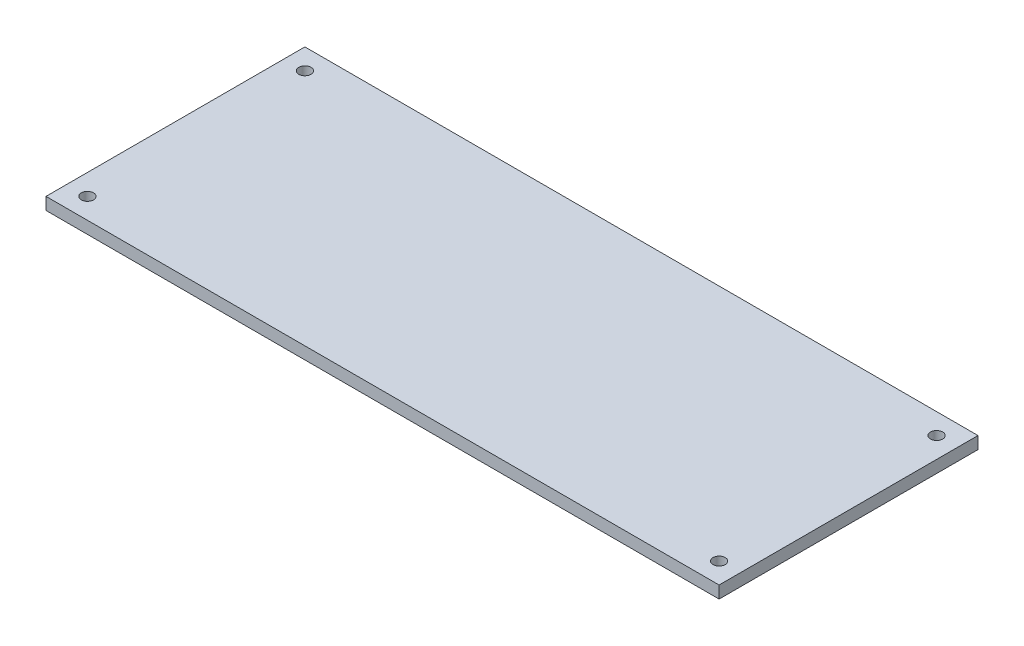
from build123d import *

# Parameters (mm, degrees)
SKETCH1_W           = 165.1
SKETCH1_H           = 63.5
BOSS_EXTRUDE1_DEPTH = 3
CUT_EXTRUDE1_REACH  = 90.496
SKETCH2_R           = 1.5


with BuildPart() as part:
    # Sketch1 → Boss-Extrude1 (new body)
    with BuildSketch(Plane(origin=(0, 0, 0), x_dir=(1, 0, 0), z_dir=(0, 1, 0))):
        Rectangle(SKETCH1_W, SKETCH1_H)
    extrude(amount=BOSS_EXTRUDE1_DEPTH)

    # Sketch2 → Cut-Extrude1 (cut, up to next)
    with BuildSketch(Plane(origin=(0, 3, 0), x_dir=(1, 0, 0), z_dir=(0, 1, 0)), mode=Mode.PRIVATE) as cut_extrude1_sk1:
        with Locations(Location((-77.47, 26.67, 0), (0, 0, 270))):
            Circle(SKETCH2_R)
    cut_extrude1_tool1 = extrude(cut_extrude1_sk1.sketch, amount=-CUT_EXTRUDE1_REACH, mode=Mode.PRIVATE) & part.part
    # Sketch2 → Cut-Extrude1 (cut, up to next)
    with BuildSketch(Plane(origin=(0, 3, 0), x_dir=(1, 0, 0), z_dir=(0, 1, 0)), mode=Mode.PRIVATE) as cut_extrude1_sk2:
        with Locations(Location((-77.47, -26.67, 0), (0, 0, 270))):
            Circle(SKETCH2_R)
    cut_extrude1_tool2 = extrude(cut_extrude1_sk2.sketch, amount=-CUT_EXTRUDE1_REACH, mode=Mode.PRIVATE) & part.part
    # Sketch2 → Cut-Extrude1 (cut, up to next)
    with BuildSketch(Plane(origin=(0, 3, 0), x_dir=(1, 0, 0), z_dir=(0, 1, 0)), mode=Mode.PRIVATE) as cut_extrude1_sk3:
        with Locations(Location((77.47, 26.67, 0), (0, 0, 270))):
            Circle(SKETCH2_R)
    cut_extrude1_tool3 = extrude(cut_extrude1_sk3.sketch, amount=-CUT_EXTRUDE1_REACH, mode=Mode.PRIVATE) & part.part
    # Sketch2 → Cut-Extrude1 (cut, up to next)
    with BuildSketch(Plane(origin=(0, 3, 0), x_dir=(1, 0, 0), z_dir=(0, 1, 0)), mode=Mode.PRIVATE) as cut_extrude1_sk4:
        with Locations(Location((77.47, -26.67, 0), (0, 0, 270))):
            Circle(SKETCH2_R)
    cut_extrude1_tool4 = extrude(cut_extrude1_sk4.sketch, amount=-CUT_EXTRUDE1_REACH, mode=Mode.PRIVATE) & part.part
    add(cut_extrude1_tool1.solids().sort_by_distance((-77.47, 3, -26.67))[0], mode=Mode.SUBTRACT)
    add(cut_extrude1_tool2.solids().sort_by_distance((-77.47, 3, 26.67))[0], mode=Mode.SUBTRACT)
    add(cut_extrude1_tool3.solids().sort_by_distance((77.47, 3, -26.67))[0], mode=Mode.SUBTRACT)
    add(cut_extrude1_tool4.solids().sort_by_distance((77.47, 3, 26.67))[0], mode=Mode.SUBTRACT)


solid = part.part
